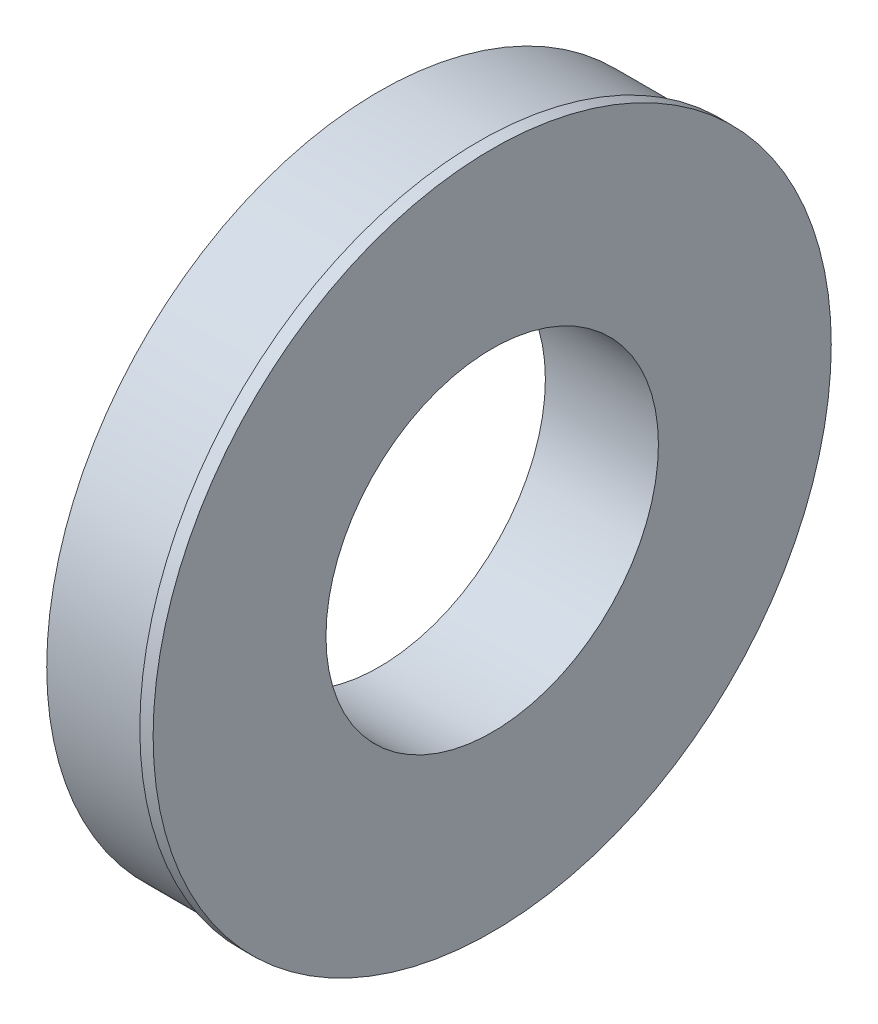
from build123d import *

# Parameters (mm, degrees)
SKETCH1_R           = 63.5
SKETCH1_R_2         = 31.75
BOSS_EXTRUDE1_DEPTH = 19.05
SKETCH2_R           = 64.77
SKETCH2_R_2         = 31.75
BOSS_EXTRUDE2_DEPTH = 2.54


with BuildPart() as part:
    # Sketch1 → Boss-Extrude1 (new body)
    with BuildSketch(Plane(origin=(0, 0, 0), x_dir=(0, 0, -1), z_dir=(1, 0, 0))):
        with Locations(Location((0, 0, 0), (0, 0, 180))):
            Circle(SKETCH1_R)
        with Locations(Location((0, 0, 0), (0, 0, 180))):
            Circle(SKETCH1_R_2, mode=Mode.SUBTRACT)
    extrude(amount=BOSS_EXTRUDE1_DEPTH)

    # Sketch2 → Boss-Extrude2 (add)
    with BuildSketch(Plane(origin=(19.05, 0, 0), x_dir=(0, 0, -1), z_dir=(1, 0, 0))):
        Circle(SKETCH2_R)
        with Locations(Location((0, 0, 0), (0, 0, 180))):
            Circle(SKETCH2_R_2, mode=Mode.SUBTRACT)
    extrude(amount=BOSS_EXTRUDE2_DEPTH)


solid = part.part
